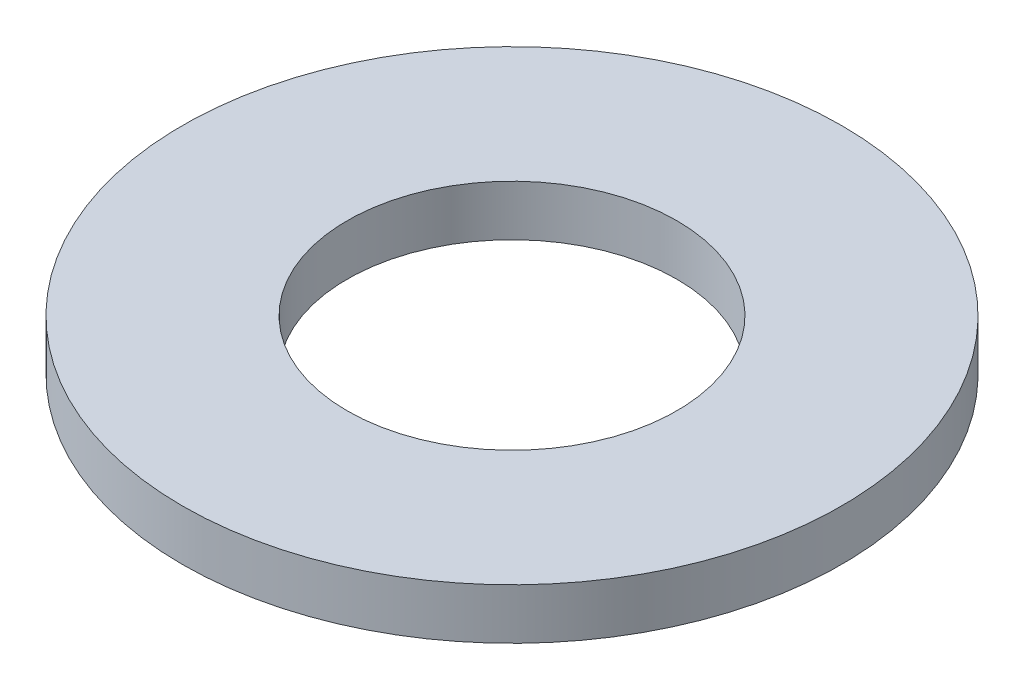
from build123d import *

# Parameters (mm, degrees)
SKETCH1_R           = 10.31875
SKETCH1_R_2         = 5.159375
BOSS_EXTRUDE1_DEPTH = 1.5875


with BuildPart() as part:
    # Sketch1 → Boss-Extrude1 (new body)
    with BuildSketch(Plane(origin=(0, 0, 0), x_dir=(1, 0, 0), z_dir=(0, 1, 0))):
        with Locations(Location((0, 0, 0), (0, 0, 270))):
            Circle(SKETCH1_R)
        with Locations(Location((0, 0, 0), (0, 0, 270))):
            Circle(SKETCH1_R_2, mode=Mode.SUBTRACT)
    extrude(amount=BOSS_EXTRUDE1_DEPTH)


solid = part.part
